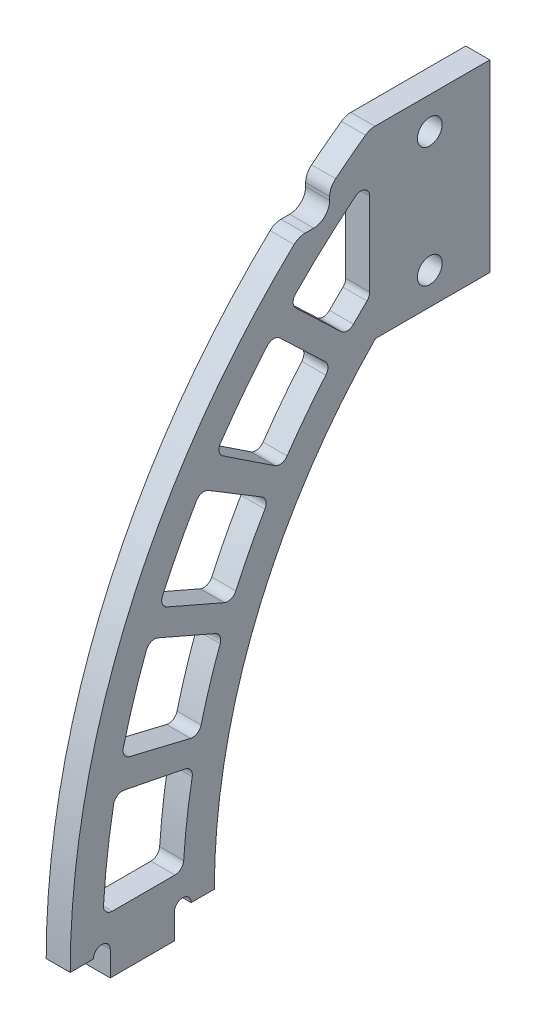
from build123d import *

# Parameters (mm, degrees)
SKETCH_1_R          = 1.55
EXTRUDE_1_DEPTH     = 3
FILLET_1_R          = 1.1
SKETCH_2_W          = 5.927431674
SKETCH_2_H          = 6.747498384
CUT_EXTRUDE_1_DEPTH = 10
FILLET_2_R          = 2


with BuildPart() as part:
    # 草图1 → 凸台-拉伸1 (new body)
    with BuildSketch(Plane(origin=(0, 0, 0), x_dir=(0, 0, -1), z_dir=(1, 0, 0))):
        with BuildLine():
            ThreePointArc((-42, -68.5), (-40.95, -67.45), (-39.9, -68.5))
            Line((-39.9, -68.5), (-39.9, -71.6))
            Line((-39.9, -71.6), (-31.9, -71.6))
            Line((-31.9, -71.6), (-31.9, -68.5))
            ThreePointArc((-31.9, -68.5), (-30.85, -67.45), (-29.8, -68.5))
            Line((-29.8, -68.5), (-26.9, -68.5))
            ThreePointArc((-26.9, -68.5), (-21.67999009, -41.785074582), (-6.787840486, -19))
            Line((-6.787840486, -19), (7.5, -19))
            Line((7.5, -19), (7.5, 4))
            Line((7.5, 4), (-7.5, 4))
            ThreePointArc((-7.5, 4), (-34.999100763, -27.710877676), (-44.9, -68.5))
            Line((-44.9, -68.5), (-42, -68.5))
        make_face()
        with BuildLine():
            Line((-30.793215628, -64.5), (-40.805797705, -64.5))
            ThreePointArc((-40.805797705, -64.5), (-40.271828479, -58.18700937), (-39.268965575, -51.931352743))
            Line((-39.268965575, -51.931352743), (-29.460918095, -53.881277009))
            ThreePointArc((-29.460918095, -53.881277009), (-30.316784958, -59.166835176), (-30.793215628, -64.5))
        make_face(mode=Mode.SUBTRACT)
        with BuildLine():
            Line((-34.979756463, -37.338397808), (-25.805292651, -41.334732969))
            ThreePointArc((-25.805292651, -41.334732969), (-27.472904513, -46.09199558), (-28.817045963, -50.950571569))
            Line((-28.817045963, -50.950571569), (-38.539210298, -48.609733975))
            ThreePointArc((-38.539210298, -48.609733975), (-36.955711073, -42.91209778), (-34.979756463, -37.338397808))
        make_face(mode=Mode.SUBTRACT)
        with BuildLine():
            Line((-28.576156327, -24.426712573), (-20.026519864, -29.613591821))
            ThreePointArc((-20.026519864, -29.613591821), (-22.494886937, -34.009003163), (-24.662290725, -38.560358752))
            Line((-24.662290725, -38.560358752), (-33.830271356, -34.566847621))
            ThreePointArc((-33.830271356, -34.566847621), (-31.373767539, -29.408407631), (-28.576156327, -24.426712573))
        make_face(mode=Mode.SUBTRACT)
        with BuildLine():
            Line((-19.554533637, -12.18081642), (-12.300184819, -19.073994509))
            ThreePointArc((-12.300184819, -19.073994509), (-15.49430702, -22.974002232), (-18.419117678, -27.079846784))
            Line((-18.419117678, -27.079846784), (-26.754350152, -21.555002932))
            ThreePointArc((-26.754350152, -21.555002932), (-23.317641268, -16.742564875), (-19.554533637, -12.18081642))
        make_face(mode=Mode.SUBTRACT)
        with Locations((0, -15)):
            Circle(SKETCH_1_R, mode=Mode.SUBTRACT)
        with BuildLine():
            ThreePointArc((-17.526444973, -9.969558223), (-12.691914425, -5.270049035), (-7.5, -0.968642657))
            Line((-7.5, -0.968642657), (-7.5, -14.084287323))
            ThreePointArc((-7.5, -14.084287323), (-8.906765299, -15.452898351), (-10.277222475, -16.857865213))
            Line((-10.277222475, -16.857865213), (-17.526444973, -9.969558223))
        make_face(mode=Mode.SUBTRACT)
        Circle(SKETCH_1_R, mode=Mode.SUBTRACT)
    extrude(amount=EXTRUDE_1_DEPTH)

    # 圆角1
    fillet_1_edges = [part.edges().sort_by_distance(p)[0] for p in [
        (1.5, -12.18081642, 19.554533637),
        (1.5, -21.555002932, 26.754350152),
        (1.5, -27.079846784, 18.419117678),
        (1.5, -19.073994509, 12.300184819),
        (1.5, -24.426712573, 28.576156327),
        (1.5, -34.566847621, 33.830271356),
        (1.5, -38.560358752, 24.662290725),
        (1.5, -29.613591821, 20.026519864),
        (1.5, -51.931352743, 39.268965575),
        (1.5, -64.5, 40.805797705),
        (1.5, -64.5, 30.793215628),
        (1.5, -53.881277009, 29.460918095),
        (1.5, -37.338397808, 34.979756463),
        (1.5, -48.609733975, 38.539210298),
        (1.5, -50.950571569, 28.817045963),
        (1.5, -41.334732969, 25.805292651),
        (1.5, -0.968642657, 7.5),
        (1.5, -9.969558223, 17.526444973),
        (1.5, -16.857865213, 10.277222475),
        (1.5, -14.084287323, 7.5),
    ]]
    fillet(fillet_1_edges, radius=FILLET_1_R)

    # 草图2 → 切除-拉伸1 (cut)
    with BuildSketch(Plane(origin=(3, 0, 0), x_dir=(0, 0, -1), z_dir=(1, 0, 0))):
        with Locations((-15.463715837, 0.173749192)):
            Rectangle(SKETCH_2_W, SKETCH_2_H)
    extrude(amount=-CUT_EXTRUDE_1_DEPTH, mode=Mode.SUBTRACT)

    # 圆角2
    fillet_2_edges = [part.edges().sort_by_distance(p)[0] for p in [
        (1.5, 0.16980982, 12.5),
        (1.5, -3.2, 16.358570309),
        (1.5, -3.2, 12.5),
        (1.5, 4, 7.5),
    ]]
    fillet(fillet_2_edges, radius=FILLET_2_R)


solid = part.part
